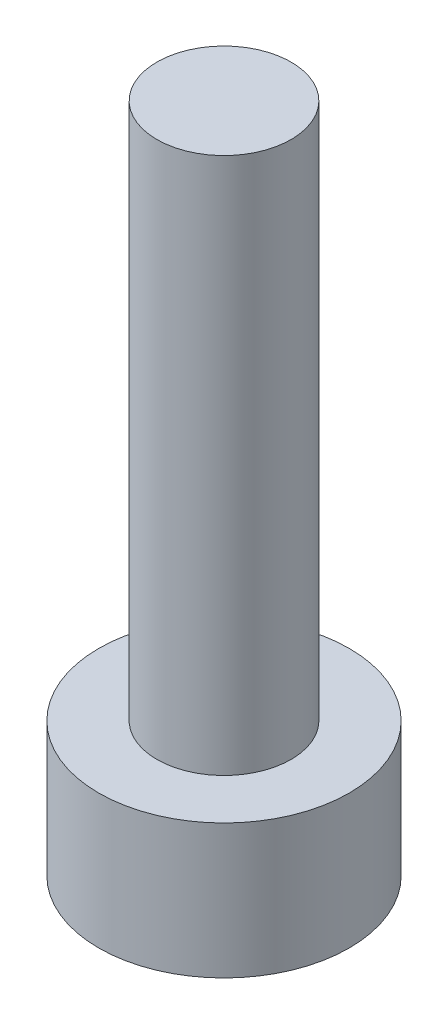
from build123d import *

# Parameters (mm, degrees)
SKETCH_1_R          = 2.8
EXTRUDE_1_DEPTH     = 3
SKETCH_2_R          = 1.5
EXTRUDE_2_DEPTH     = 12
CUT_EXTRUDE_1_DEPTH = 1.5


with BuildPart() as part:
    # 草图1 → 凸台-拉伸1 (new body)
    with BuildSketch(Plane(origin=(0, 0, 0), x_dir=(1, 0, 0), z_dir=(0, 1, 0))):
        with Locations(Location((0, 0, 0), (0, 0, 270))):
            Circle(SKETCH_1_R)
    extrude(amount=EXTRUDE_1_DEPTH)

    # 草图2 → 凸台-拉伸2 (add)
    with BuildSketch(Plane(origin=(0, 3, 0), x_dir=(1, 0, 0), z_dir=(0, 1, 0))):
        with Locations(Location((0, 0, 0), (0, 0, 270))):
            Circle(SKETCH_2_R)
    extrude(amount=EXTRUDE_2_DEPTH)

    # 草图3 → 切除-拉伸1 (cut)
    with BuildSketch(Plane.XZ):
        Polygon((1.084583442, -0.952371824), (1.367069914, 0.463090901), (0.282486472, 1.415462725), (-1.084583442, 0.952371824), (-1.367069914, -0.463090901), (-0.282486472, -1.415462725), align=None)
    extrude(amount=-CUT_EXTRUDE_1_DEPTH, mode=Mode.SUBTRACT)


solid = part.part
